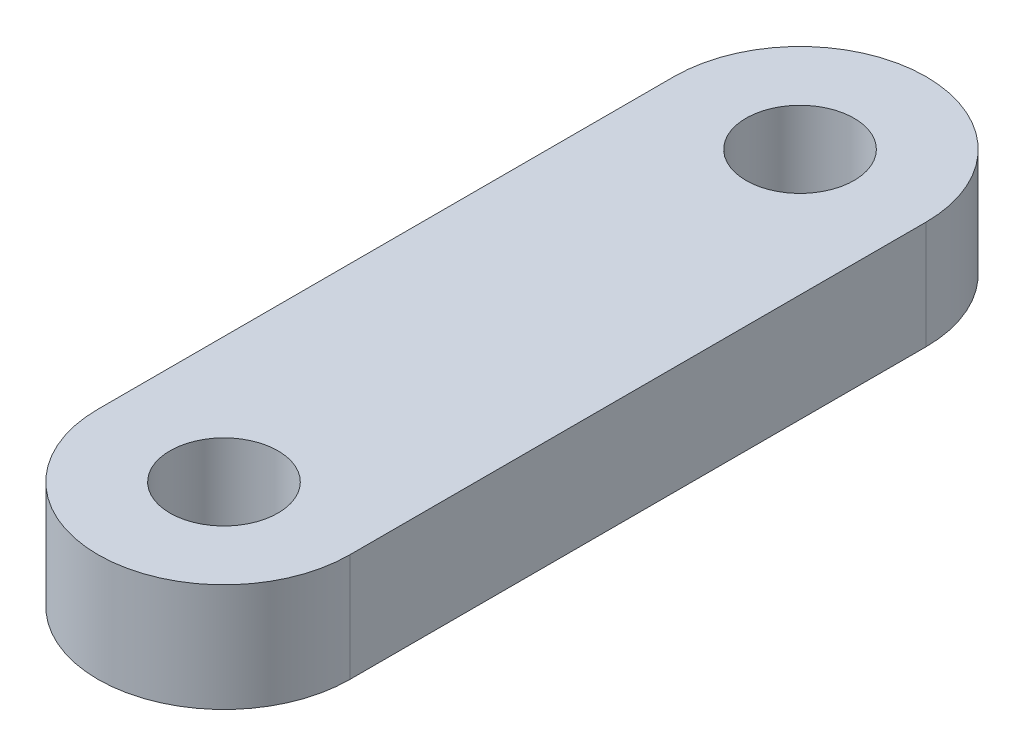
from build123d import *

# Parameters (mm, degrees)
EXTRUDE_1_DEPTH     = 3
SKETCH_2_R          = 1.5
CUT_EXTRUDE_1_DEPTH = 3


with BuildPart() as part:
    # 草图1 → 凸台-拉伸1 (new body)
    with BuildSketch(Plane(origin=(0, 0, 0), x_dir=(1, 0, 0), z_dir=(0, 1, 0))):
        with BuildLine():
            Line((-3.5, -8), (-3.5, 8))
            ThreePointArc((-3.5, 8), (0, 11.5), (3.5, 8))
            Line((3.5, 8), (3.5, -8))
            ThreePointArc((3.5, -8), (0, -11.5), (-3.5, -8))
        make_face()
    extrude(amount=EXTRUDE_1_DEPTH)

    # 草图2 → 切除-拉伸1 (cut)
    with BuildSketch(Plane(origin=(0, 3, 0), x_dir=(1, 0, 0), z_dir=(0, 1, 0))):
        with Locations(Location((0, 8, 0), (0, 0, 270))):
            Circle(SKETCH_2_R)
        with Locations(Location((0, -8, 0), (0, 0, 270))):
            Circle(SKETCH_2_R)
    extrude(amount=-CUT_EXTRUDE_1_DEPTH, mode=Mode.SUBTRACT)


solid = part.part
